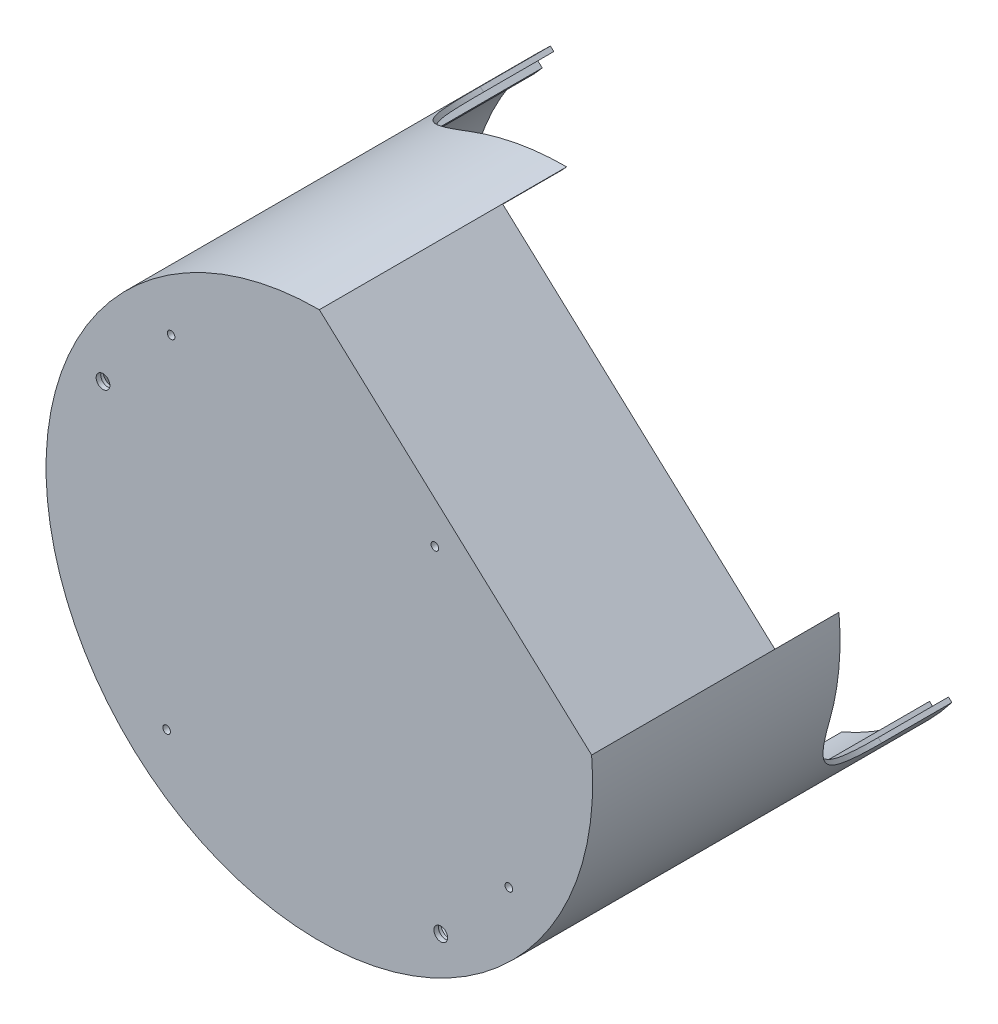
from build123d import *
from OCP.BRepFilletAPI import BRepFilletAPI_MakeChamfer

# Parameters (mm, degrees)
EXTRUDE_1_DEPTH      = 136
CUT_EXTRUDE_2_REACH  = 237.709
SKETCH_2_W           = 120.930647164
SKETCH_2_H           = 76
EXTRUDE_START        = -3
EXTRUDE_11_DEPTH     = 3
EXTRUDE5_REACH       = 257.268
EXTRUDE5_END_RADIUS  = 88
SKETCH_16_R          = 2.25
CUT_EXTRUDE_12_DEPTH = 1.5
SKETCH_17_R          = 3
CUT_EXTRUDE_13_DEPTH = 2
CUT_EXTRUDE_START    = -10
CUT_EXTRUDE_22_DEPTH = 62
EXTRUDE_25_DEPTH     = 57
EXTRUDE_START_2      = 133
EXTRUDE_26_DEPTH     = 133
EXTRUDE_27_DEPTH     = 133
EXTRUDE3_DEPTH       = 20
SKETCH_37_R          = 3
EXTRUDE_28_DEPTH     = 6
CHAMFER_1_SIZE       = 3
CHAMFER_1_SIZE2      = 0.528980942
CUT_EXTRUDE_1_DEPTH  = 100
HOLE_WIZARD_M3_1_D   = 2.5


with BuildPart() as part:
    # 草图1 → 拉伸1 (new body)
    with BuildSketch(Plane.XY):
        with BuildLine():
            Line((89.159425479, 7.800438976), (0, 89.5))
            ThreePointArc((0, 89.5), (-60.465323582, -65.986321645), (89.159425479, 7.800438976))
        make_face()
        with BuildLine():
            Line((-0.581223379, 87.998080544), (87.713878235, 7.090526422))
            ThreePointArc((87.713878235, 7.090526422), (-59.45193827, -64.880405639), (-0.581223379, 87.998080544))
        make_face(mode=Mode.SUBTRACT)
    extrude(amount=EXTRUDE_1_DEPTH)

    # 草图2 → 拉伸2 (cut, up to next)
    with BuildSketch(Plane(origin=(44.57971274, 48.650219488, 0), x_dir=(0.7372773368101252, -0.675590207615659, 0), z_dir=(0.675590207615659, 0.7372773368101252, 0)), mode=Mode.PRIVATE) as cut_extrude_2_sk1:
        with Locations((0, -38)):
            Rectangle(SKETCH_2_W, SKETCH_2_H)
    cut_extrude_2_tool1 = extrude(cut_extrude_2_sk1.sketch, amount=-CUT_EXTRUDE_2_REACH, mode=Mode.PRIVATE) & part.part
    add(cut_extrude_2_tool1.solids().sort_by_distance((44.579713, 48.650219, 38))[0], mode=Mode.SUBTRACT)

    # 草图15 → 拉伸11 (add)
    with BuildSketch(Plane.XY.offset(136).offset(EXTRUDE_START)):
        with BuildLine():
            Line((89.159425479, 7.800438976), (0, 89.5))
            ThreePointArc((0, 89.5), (-60.465323582, -65.986321645), (89.159425479, 7.800438976))
        make_face()
    extrude(amount=EXTRUDE_11_DEPTH)

    # Extrude5: up to this cylinder (the profile starts outside it)
    extrude5_end = Plane(origin=(0, 0, 93.5), z_dir=(0, 0, -1)) * Cylinder(EXTRUDE5_END_RADIUS, 691.536, mode=Mode.PRIVATE)
    # Sketch3 → Extrude5 (cut, up to the surface)
    with BuildSketch(Plane(origin=(-60.465323582, -65.986321645, 136), x_dir=(0.7372773368101254, -0.6755902076156588, 0), z_dir=(-0.6755902076156588, -0.7372773368101254, 0)), mode=Mode.PRIVATE) as extrude5_sk1:
        with BuildLine():
            Line((55, -30), (55, -55))
            ThreePointArc((55, -55), (45, -65), (35, -55))
            Line((35, -55), (35, -30))
            ThreePointArc((35, -30), (45, -20), (55, -30))
        make_face()
    extrude5_tool1 = extrude(extrude5_sk1.sketch, amount=-EXTRUDE5_REACH, mode=Mode.PRIVATE) - extrude5_end
    extrude5 = extrude5_tool1.solids().sort_by_distance((-27.287843, -96.387881, 93.5))[0]
    add(extrude5, mode=Mode.SUBTRACT)

    # Mirror2: Extrude5 across plane
    add(extrude5.mirror(Plane(origin=(0, 0, 0), x_dir=(0, 0, 1), z_dir=(-0.7372773368101253, 0.6755902076156589, 0))), mode=Mode.SUBTRACT)

    # 草图16 → 拉伸12 (cut)
    with BuildSketch(Plane.XY.offset(136)):
        with Locations((39.757225486, -67.626644318)):
            Circle(SKETCH_16_R)
        with Locations((-70.834375036, 33.711886825)):
            Circle(SKETCH_16_R)
    extrude(amount=-CUT_EXTRUDE_12_DEPTH, mode=Mode.SUBTRACT)

    # 草图17 → 拉伸13 (cut)
    with BuildSketch(Plane.XY.offset(134.5)):
        with Locations((-70.834375036, 33.711886825)):
            Circle(SKETCH_17_R)
        with Locations((39.757225486, -67.626644318)):
            Circle(SKETCH_17_R)
    extrude(amount=-CUT_EXTRUDE_13_DEPTH, mode=Mode.SUBTRACT)

    # 草图22 → 拉伸22 (cut)
    with BuildSketch(Plane(origin=(44.57971274, -40.849780512, 0), x_dir=(0, 0, -1), z_dir=(0.737277336810123, -0.6755902076156615, 0)).offset(CUT_EXTRUDE_START)):
        with BuildLine():
            Line((-23, 7.986321645), (5, 7.986321645))
            Line((5, 7.986321645), (5, 65.986321645))
            Line((5, 65.986321645), (-55, 65.986321645))
            Line((-55, 65.986321645), (-55, 39.986321645))
            ThreePointArc((-55, 39.986321645), (-45.627416998, 17.358904647), (-23, 7.986321645))
        make_face()
    cut_extrude_22 = extrude(amount=CUT_EXTRUDE_22_DEPTH, mode=Mode.SUBTRACT)

    # 镜向6: 拉伸22 across plane
    add(cut_extrude_22.mirror(Plane(origin=(0, 0, 0), x_dir=(0, 0, 1), z_dir=(-0.7372773368101253, 0.6755902076156589, 0))), mode=Mode.SUBTRACT)

    # 草图28 → 拉伸25 (add)
    with BuildSketch(Plane(origin=(0, 0, 133), x_dir=(-1, 0, 0), z_dir=(0, 0, -1))):
        Polygon((-42.091772755, 48.895483898), (-45.040882102, 46.193123068), (-43.689701687, 44.718568394), (-40.740592339, 47.420929224), align=None)
    extrude(amount=EXTRUDE_25_DEPTH)

    # 草图29 → 拉伸26 (add)
    with BuildSketch(Plane(origin=(0, 0, 133), x_dir=(-1, 0, 0), z_dir=(0, 0, -1)).offset(EXTRUDE_START_2)):
        with BuildLine():
            Line((75.338803478, -41.473662612), (77.185797931, -37.92561928))
            Line((77.185797931, -37.92561928), (78.980816488, -38.807610426))
            ThreePointArc((78.980816488, -38.807610426), (78.05695332, -40.633877965), (77.090868675, -42.438166394))
            Line((77.090868675, -42.438166394), (75.338803478, -41.473662612))
        make_face()
    extrude_26 = extrude(amount=-EXTRUDE_26_DEPTH)

    # 草图34 → 拉伸27 (add)
    with BuildSketch(Plane(origin=(0, 0, 133), x_dir=(-1, 0, 0), z_dir=(0, 0, -1)).offset(EXTRUDE_START_2)):
        with BuildLine():
            Line((-62.512059432, -61.93740732), (-61.059705317, -60.562391857))
            Line((-61.059705317, -60.562391857), (-63.809736245, -57.657683627))
            Line((-63.809736245, -57.657683627), (-65.262090359, -59.032699091))
            ThreePointArc((-65.262090359, -59.032699091), (-63.903581052, -60.500680399), (-62.512059432, -61.93740732))
        make_face()
    extrude_27 = extrude(amount=-EXTRUDE_27_DEPTH)

    # 镜向9: 拉伸26 across plane
    add(extrude_26.mirror(Plane(origin=(0, 0, 0), x_dir=(0, 0, 1), z_dir=(0.737277336810125, -0.6755902076156591, 0))))

    # 镜向8: 拉伸27 across plane
    add(extrude_27.mirror(Plane(origin=(0, 0, 0), x_dir=(0, 0, 1), z_dir=(-0.7372773368101253, 0.6755902076156589, 0))))

    # Sketch1 → Extrude3 (cut)
    with BuildSketch(Plane(origin=(0, 0, 0), x_dir=(-1, 0, 0), z_dir=(0, 0, -1))):
        with BuildLine():
            Line((89.490548743, 1.300648151), (-9.095314037, -89.036651232))
            ThreePointArc((-9.095314037, -89.036651232), (60.465323582, -65.986321645), (89.490548743, 1.300648151))
        make_face()
    extrude(amount=-EXTRUDE3_DEPTH, mode=Mode.SUBTRACT)

    # 草图37 → 拉伸28 (add)
    with BuildSketch(Plane.XY.offset(136)):
        with Locations((62.051702337, -43.296492203)):
            Circle(SKETCH_37_R)
        with Locations((-48.539898185, 58.042038939)):
            Circle(SKETCH_37_R)
        with Locations((-50.002916327, -54.568607665)):
            Circle(SKETCH_37_R)
        with Locations((37.823810663, 41.27744612)):
            Circle(SKETCH_37_R)
    extrude(amount=-EXTRUDE_28_DEPTH)

    # 倒角1: one chamfer whose edges measure the first distance from different faces: ONE call of the kernel's chamfer builder (chamfer() names one face for all edges)
    chamfer_1_edges_1 = [part.edges().sort_by_distance(p)[0] for p in [
        (59.051702337, -43.296492203, 130),
    ]]
    chamfer_1_side_1 = [part.faces().sort_by_distance(p)[0] for p in [
        (62.051702337, -43.296492203, 130),
    ]]
    chamfer_1_edges_2 = [part.edges().sort_by_distance(p)[0] for p in [
        (-51.539898185, 58.042038939, 130),
    ]]
    chamfer_1_side_2 = [part.faces().sort_by_distance(p)[0] for p in [
        (-48.539898185, 58.042038939, 130),
    ]]
    chamfer_1_edges_3 = [part.edges().sort_by_distance(p)[0] for p in [
        (-53.002916327, -54.568607665, 130),
    ]]
    chamfer_1_side_3 = [part.faces().sort_by_distance(p)[0] for p in [
        (-50.002916327, -54.568607665, 130),
    ]]
    chamfer_1_edges_4 = [part.edges().sort_by_distance(p)[0] for p in [
        (34.823810663, 41.27744612, 130),
    ]]
    chamfer_1_side_4 = [part.faces().sort_by_distance(p)[0] for p in [
        (37.823810663, 41.27744612, 130),
    ]]
    chamfer_1 = BRepFilletAPI_MakeChamfer(part.part.solid().wrapped)
    for e in chamfer_1_edges_1:
        chamfer_1.Add(CHAMFER_1_SIZE, CHAMFER_1_SIZE2, e.wrapped, chamfer_1_side_1[0].wrapped)  # the first distance lies on this face
    for e in chamfer_1_edges_2:
        chamfer_1.Add(CHAMFER_1_SIZE, CHAMFER_1_SIZE2, e.wrapped, chamfer_1_side_2[0].wrapped)  # the first distance lies on this face
    for e in chamfer_1_edges_3:
        chamfer_1.Add(CHAMFER_1_SIZE, CHAMFER_1_SIZE2, e.wrapped, chamfer_1_side_3[0].wrapped)  # the first distance lies on this face
    for e in chamfer_1_edges_4:
        chamfer_1.Add(CHAMFER_1_SIZE, CHAMFER_1_SIZE2, e.wrapped, chamfer_1_side_4[0].wrapped)  # the first distance lies on this face
    add(Compound.cast(chamfer_1.Shape()), mode=Mode.REPLACE)

    # 草图42 → 切除-拉伸1 (cut)
    with BuildSketch(Plane(origin=(0, 0, 0), x_dir=(0, 0, -1), z_dir=(0.9990482215818578, 0.043619387365336104, 0))):
        with BuildLine():
            Line((-23, -34.5), (10, -34.5))
            Line((10, -34.5), (10, -1.5))
            Line((10, -1.5), (10, 31.5))
            Line((10, 31.5), (-23, 31.5))
            ThreePointArc((-23, 31.5), (-56, -1.5), (-23, -34.5))
        make_face()
    cut_extrude_1 = extrude(amount=-CUT_EXTRUDE_1_DEPTH, mode=Mode.SUBTRACT)

    # 镜向10: 切除-拉伸1 across plane
    add(cut_extrude_1.mirror(Plane(origin=(0, 0, 0), x_dir=(0, 0, 1), z_dir=(0.737277336810125, -0.6755902076156591, 0))), mode=Mode.SUBTRACT)

    # M3 螺纹孔1 (through all)
    with Locations(Plane(origin=(-48.539898185, 58.042038939, 136), x_dir=(1, 0, 0), z_dir=(0, 0, 1))):
        with Locations((0, 0), (110.591600522, -101.338531142), (-1.463018142, -112.610646604), (86.363708848, -16.764592819)):
            Hole(HOLE_WIZARD_M3_1_D / 2)


solid = part.part
